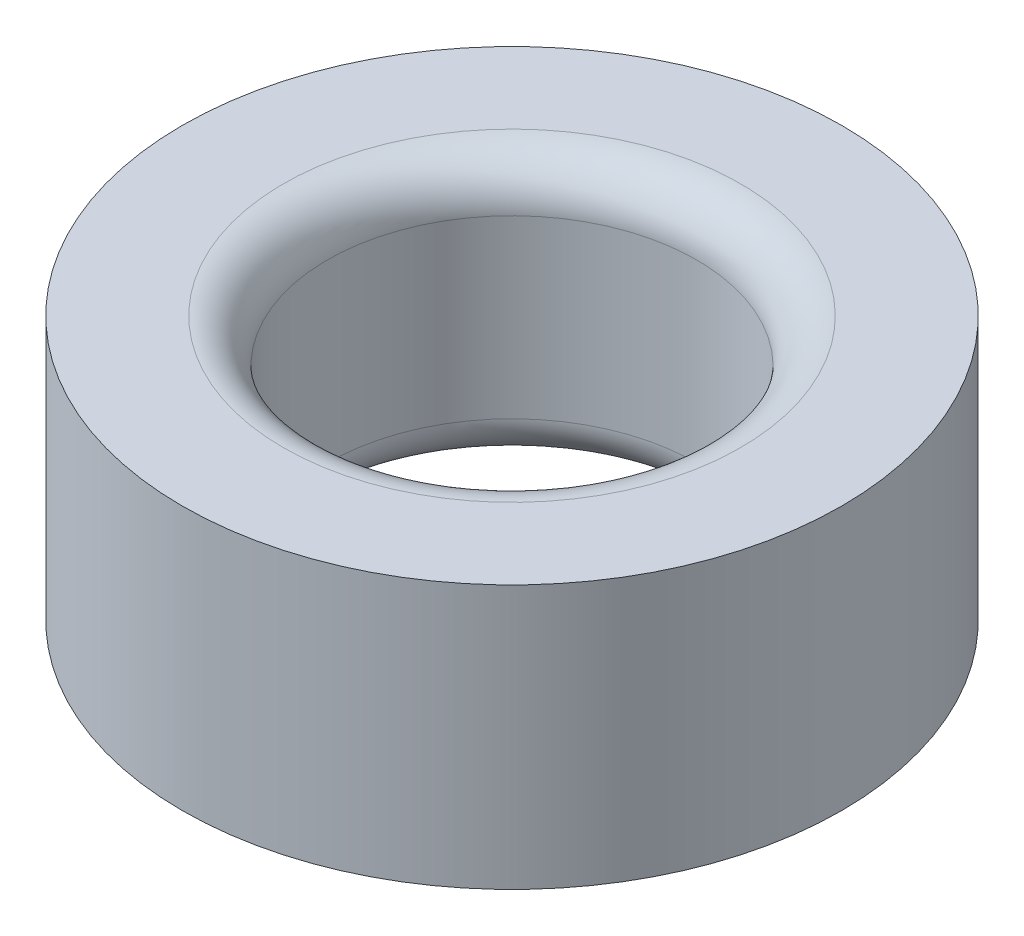
from build123d import *

# Parameters (mm, degrees)
SKETCH1_R           = 3.75
SKETCH1_R_2         = 2.1
BOSS_EXTRUDE1_DEPTH = 3
FILLET1_R           = 0.5


with BuildPart() as part:
    # Sketch1 → Boss-Extrude1 (new body)
    with BuildSketch(Plane(origin=(0, 0, 0), x_dir=(1, 0, 0), z_dir=(0, 1, 0))):
        with Locations(Location((0, 0, 0), (0, 0, 270))):
            Circle(SKETCH1_R)
        with Locations(Location((0, 0, 0), (0, 0, 270))):
            Circle(SKETCH1_R_2, mode=Mode.SUBTRACT)
    extrude(amount=BOSS_EXTRUDE1_DEPTH)

    # Fillet1
    fillet1_edges = [part.edges().sort_by_distance(p)[0] for p in [
        (0, 0, -2.1),
        (0, 3, -2.1),
    ]]
    fillet(fillet1_edges, radius=FILLET1_R)


solid = part.part
